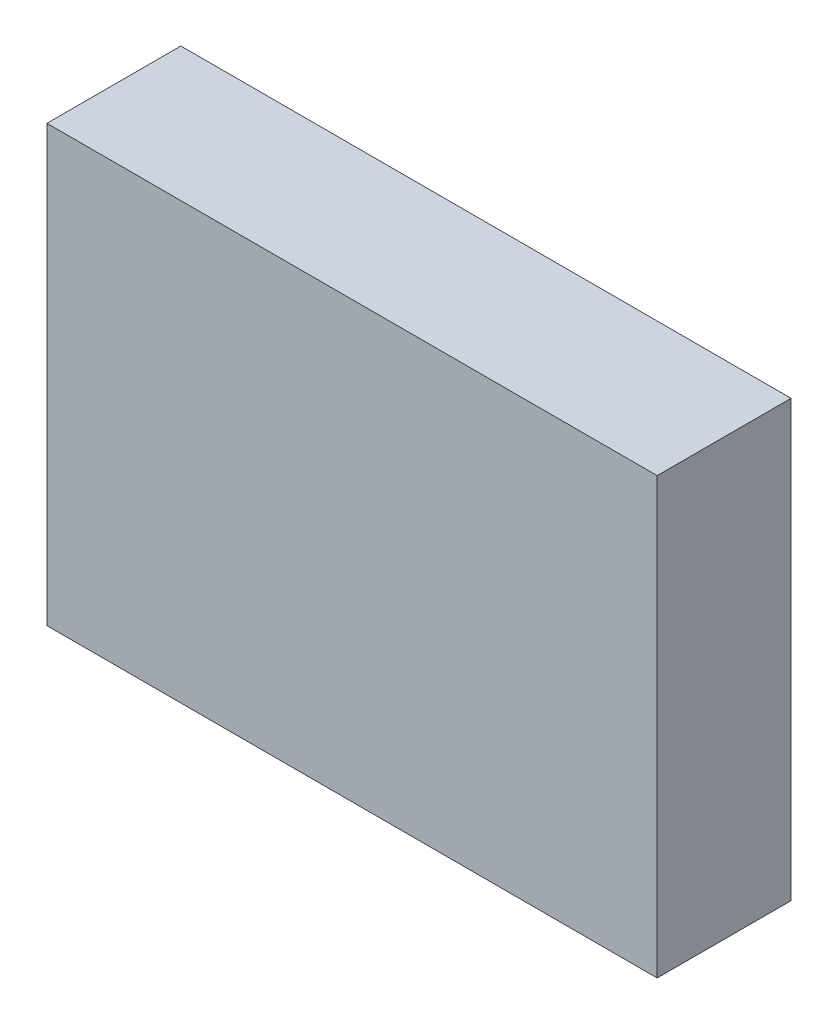
from build123d import *

# Parameters (mm, degrees)
SKETCH1_W           = 22.787370912
SKETCH1_H           = 16.246551484
BOSS_EXTRUDE1_DEPTH = 5


with BuildPart() as part:
    # Sketch1 → Boss-Extrude1 (new body)
    with BuildSketch(Plane.XY):
        with Locations((91.787092409, -30.624062019)):
            Rectangle(SKETCH1_W, SKETCH1_H)
    extrude(amount=BOSS_EXTRUDE1_DEPTH)


solid = part.part
